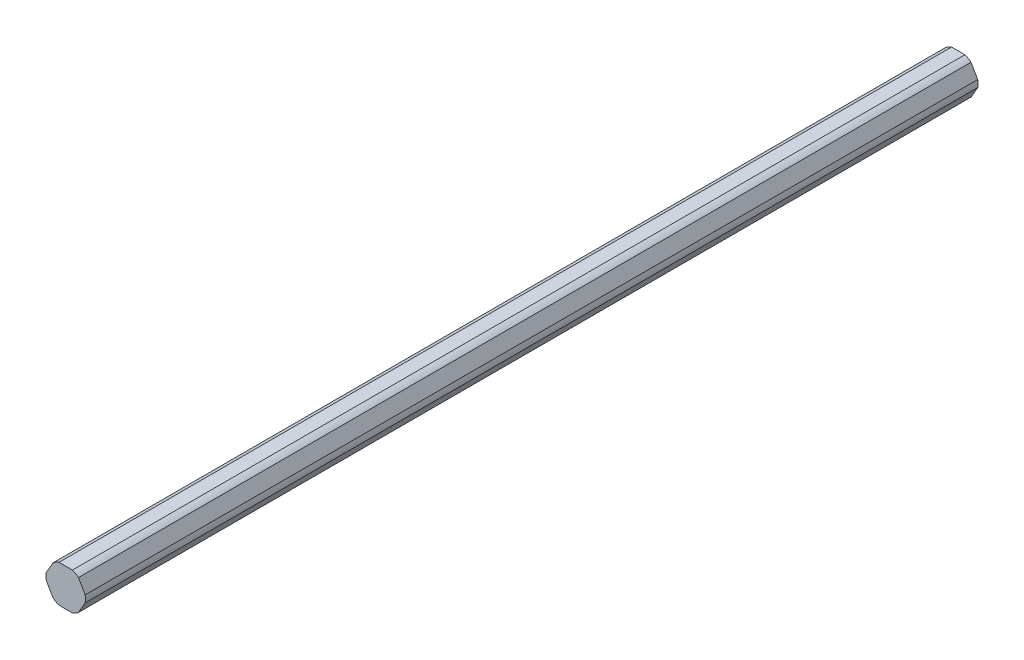
from build123d import *

# Parameters (mm, degrees)
BOSS_EXTRUDE1_DEPTH = 304.8


with BuildPart() as part:
    # Sketch1 → Boss-Extrude1 (new body)
    with BuildSketch(Plane.XY):
        with BuildLine():
            ThreePointArc((-6.643813628, 1.19257724), (-6.75, 0), (-6.643813628, -1.19257724))
            Line((-6.643813628, -1.19257724), (-4.354709, -5.15742276))
            ThreePointArc((-4.354709, -5.15742276), (-3.375, -5.845671476), (-2.289104628, -6.35))
            Line((-2.289104628, -6.35), (2.289104628, -6.35))
            ThreePointArc((2.289104628, -6.35), (3.375, -5.845671476), (4.354709, -5.15742276))
            Line((4.354709, -5.15742276), (6.643813628, -1.19257724))
            ThreePointArc((6.643813628, -1.19257724), (6.723400999, -0.598647646), (6.75, 0))
            ThreePointArc((6.75, 0), (6.723400999, 0.598647646), (6.643813628, 1.19257724))
            Line((6.643813628, 1.19257724), (4.354709, 5.15742276))
            ThreePointArc((4.354709, 5.15742276), (3.375, 5.845671476), (2.289104628, 6.35))
            Line((2.289104628, 6.35), (-2.289104628, 6.35))
            ThreePointArc((-2.289104628, 6.35), (-3.375, 5.845671476), (-4.354709, 5.15742276))
            Line((-4.354709, 5.15742276), (-6.643813628, 1.19257724))
        make_face()
    extrude(amount=BOSS_EXTRUDE1_DEPTH)


solid = part.part
